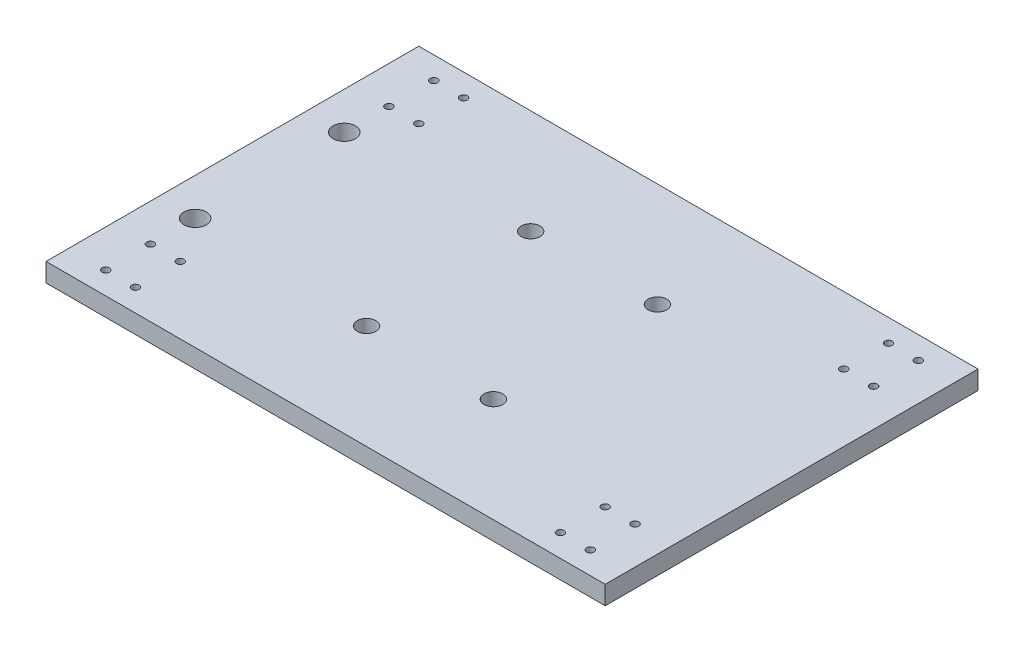
from build123d import *

# Parameters (mm, degrees)
SKETCH1_W           = 150
SKETCH1_H           = 100
BOSS_EXTRUDE1_DEPTH = 5
SKETCH2_R           = 2.5
SKETCH2_R_2         = 1
CUT_EXTRUDE1_DEPTH  = 91.277350426
SKETCH3_R           = 3
CUT_EXTRUDE2_DEPTH  = 91.277350426


with BuildPart() as part:
    # Sketch1 → Boss-Extrude1 (new body)
    with BuildSketch(Plane(origin=(0, 0, 0), x_dir=(1, 0, 0), z_dir=(0, 1, 0))):
        Rectangle(SKETCH1_W, SKETCH1_H)
    extrude(amount=BOSS_EXTRUDE1_DEPTH)

    # Sketch2 → Cut-Extrude1 (cut, through all)
    with BuildSketch(Plane(origin=(0, 5, 0), x_dir=(1, 0, 0), z_dir=(0, 1, 0))):
        with Locations(Location((17, 22, 0), (0, 0, 270))):
            Circle(SKETCH2_R)
        with Locations(Location((17, -22, 0), (0, 0, 90))):
            Circle(SKETCH2_R)
        with Locations(Location((-17, 22, 0), (0, 0, 90))):
            Circle(SKETCH2_R)
        with Locations(Location((-17, -22, 0), (0, 0, 270))):
            Circle(SKETCH2_R)
        with Locations(Location((65, 44, 0), (0, 0, 270))):
            Circle(SKETCH2_R_2)
        with Locations(Location((65, 32, 0), (0, 0, 270))):
            Circle(SKETCH2_R_2)
        with Locations(Location((57, 44, 0), (0, 0, 270))):
            Circle(SKETCH2_R_2)
        with Locations(Location((57, 32, 0), (0, 0, 270))):
            Circle(SKETCH2_R_2)
        with Locations(Location((65, -32, 0), (0, 0, 90))):
            Circle(SKETCH2_R_2)
        with Locations(Location((57, -32, 0), (0, 0, 90))):
            Circle(SKETCH2_R_2)
        with Locations(Location((65, -44, 0), (0, 0, 90))):
            Circle(SKETCH2_R_2)
        with Locations(Location((57, -44, 0), (0, 0, 90))):
            Circle(SKETCH2_R_2)
        with Locations(Location((-65, 32, 0), (0, 0, 90))):
            Circle(SKETCH2_R_2)
        with Locations(Location((-57, 32, 0), (0, 0, 90))):
            Circle(SKETCH2_R_2)
        with Locations(Location((-65, 44, 0), (0, 0, 90))):
            Circle(SKETCH2_R_2)
        with Locations(Location((-57, 44, 0), (0, 0, 90))):
            Circle(SKETCH2_R_2)
        with Locations(Location((-57, -44, 0), (0, 0, 270))):
            Circle(SKETCH2_R_2)
        with Locations(Location((-65, -44, 0), (0, 0, 270))):
            Circle(SKETCH2_R_2)
        with Locations(Location((-57, -32, 0), (0, 0, 270))):
            Circle(SKETCH2_R_2)
        with Locations(Location((-65, -32, 0), (0, 0, 270))):
            Circle(SKETCH2_R_2)
    extrude(amount=-CUT_EXTRUDE1_DEPTH, mode=Mode.SUBTRACT)

    # Sketch3 → Cut-Extrude2 (cut, through all)
    with BuildSketch(Plane(origin=(0, 5, 0), x_dir=(1, 0, 0), z_dir=(0, 1, 0))):
        with Locations(Location((-65, 20, 0), (0, 0, 270))):
            Circle(SKETCH3_R)
        with Locations(Location((-65, -20, 0), (0, 0, 90))):
            Circle(SKETCH3_R)
    extrude(amount=-CUT_EXTRUDE2_DEPTH, mode=Mode.SUBTRACT)


solid = part.part
